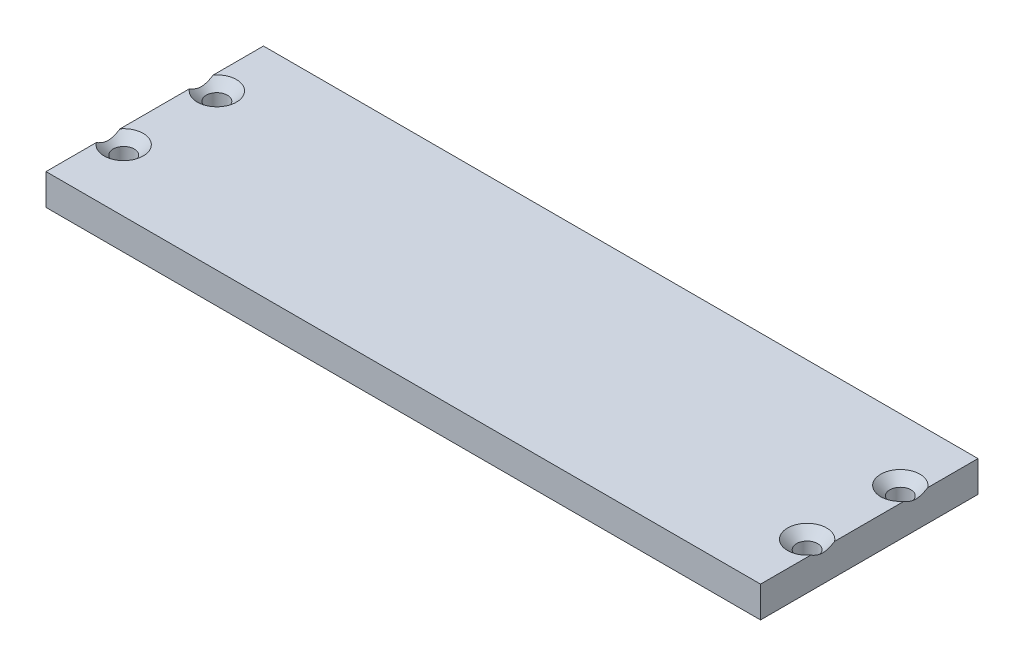
from build123d import *

# Parameters (mm, degrees)
SKETCH1_W                                           = 115
SKETCH1_H                                           = 35
BOSS_EXTRUDE1_DEPTH                                 = 5
CSK_FOR_M3_FLAT_COUNTERSUNK_HEAD_SCREW1_D           = 3.4
CSK_FOR_M3_FLAT_COUNTERSUNK_HEAD_SCREW1_CSINK_D     = 6.3
CSK_FOR_M3_FLAT_COUNTERSUNK_HEAD_SCREW1_CSINK_ANGLE = 90


with BuildPart() as part:
    # Sketch1 → Boss-Extrude1 (new body)
    with BuildSketch(Plane(origin=(0, 0, 0), x_dir=(1, 0, 0), z_dir=(0, 1, 0))):
        with Locations((57.5, 17.5)):
            Rectangle(SKETCH1_W, SKETCH1_H)
    extrude(amount=-BOSS_EXTRUDE1_DEPTH)

    # CSK for M3 Flat Countersunk Head Screw1 (through all)
    with Locations(Plane(origin=(0, 0, 0), x_dir=(1, 0, 0), z_dir=(0, 1, 0))):
        with Locations((2.5, 25), (2.5, 10), (112.5, 25), (112.5, 10)):
            CounterSinkHole(CSK_FOR_M3_FLAT_COUNTERSUNK_HEAD_SCREW1_D / 2, CSK_FOR_M3_FLAT_COUNTERSUNK_HEAD_SCREW1_CSINK_D / 2, counter_sink_angle=CSK_FOR_M3_FLAT_COUNTERSUNK_HEAD_SCREW1_CSINK_ANGLE)


solid = part.part
